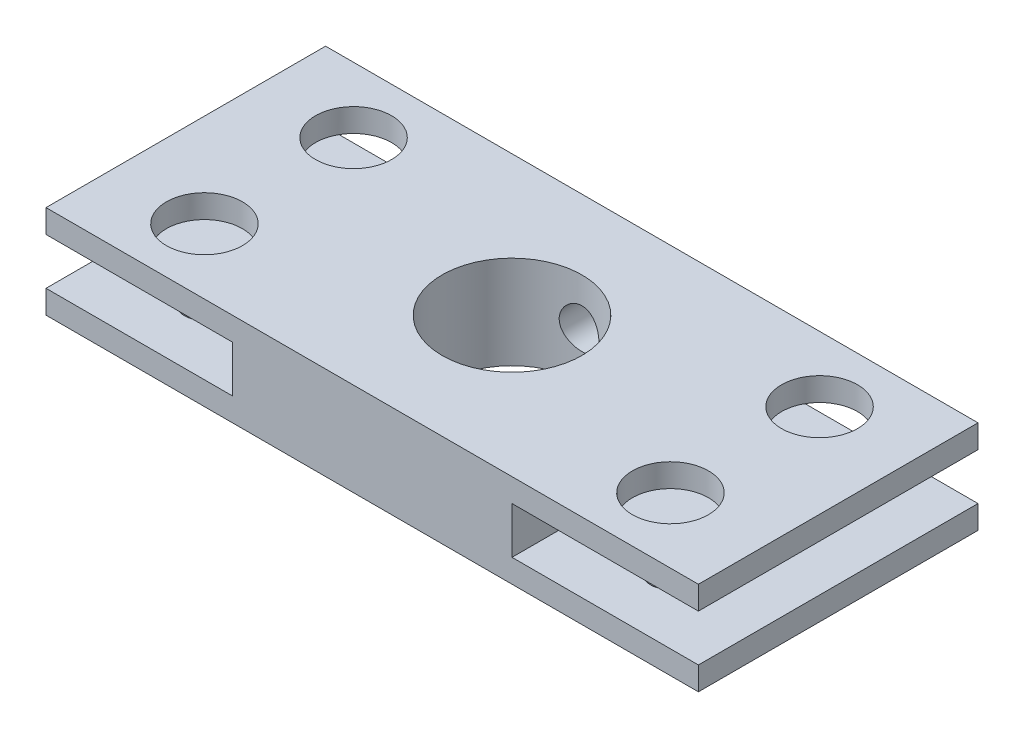
from build123d import *

# Parameters (mm, degrees)
SKETCH1_W                      = 44.45
SKETCH1_H                      = 19.05
SKETCH1_R                      = 4.7625
BOSS_EXTRUDE1_DEPTH            = 6.35
F_6_32_TAPPED_HOLE1_REACH      = 31.953
F_6_32_TAPPED_HOLE1_BORE_R     = 1.35255
SKETCH15_W                     = 12.7
SKETCH15_H                     = 3.175
CUT_EXTRUDE1_DEPTH             = 30.952890179
F_6_0_204_DIAMETER_HOLE1_D     = 5.1816
F_6_0_204_DIAMETER_HOLE1_DEPTH = 1.5875
F_6_32_TAPPED_HOLE4_D          = 2.7051


with BuildPart() as part:
    # Sketch1 → Boss-Extrude1 (new body)
    with BuildSketch(Plane(origin=(0, 0, 0), x_dir=(1, 0, 0), z_dir=(0, 1, 0))):
        Rectangle(SKETCH1_W, SKETCH1_H)
        with Locations(Location((0, 0, 0), (0, 0, 270))):
            Circle(SKETCH1_R, mode=Mode.SUBTRACT)
    extrude(amount=BOSS_EXTRUDE1_DEPTH)

    # #6-32 Tapped Hole1 bore → #6-32 Tapped Hole1 (cut, up to next)
    with BuildSketch(Plane(origin=(0, 0, -9.525), x_dir=(-1, 0, 0), z_dir=(0, 0, -1)), mode=Mode.PRIVATE) as f_6_32_tapped_hole1_sk1:
        with Locations((0, 3.175)):
            Circle(F_6_32_TAPPED_HOLE1_BORE_R)
    f_6_32_tapped_hole1_tool1 = extrude(f_6_32_tapped_hole1_sk1.sketch, amount=-F_6_32_TAPPED_HOLE1_REACH, mode=Mode.PRIVATE) & part.part
    add(f_6_32_tapped_hole1_tool1.solids().sort_by_distance((0, 3.175, -9.525))[0], mode=Mode.SUBTRACT)

    # Sketch15 → Cut-Extrude1 (cut, through all)
    with BuildSketch(Plane.XY.offset(9.525)):
        with Locations((15.875, 3.175)):
            Rectangle(SKETCH15_W, SKETCH15_H)
    cut_extrude1 = extrude(amount=-CUT_EXTRUDE1_DEPTH, mode=Mode.SUBTRACT)

    # #6 (0.204) Diameter Hole1
    with Locations(Plane(origin=(0, 6.35, 0), x_dir=(1, 0, 0), z_dir=(0, 1, 0))):
        with Locations((15.875, 5.08), (15.875, -5.08)):
            f_6_0_204_diameter_hole1 = Hole(F_6_0_204_DIAMETER_HOLE1_D / 2, depth=F_6_0_204_DIAMETER_HOLE1_DEPTH)

    # #6-32 Tapped Hole4 (through all)
    with Locations(Plane(origin=(0, 1.5875, 0), x_dir=(1, 0, 0), z_dir=(0, 1, 0))):
        with Locations((15.875, 5.08), (15.875, -5.08)):
            f_6_32_tapped_hole4 = Hole(F_6_32_TAPPED_HOLE4_D / 2)

    # Mirror3: Cut-Extrude1, #6 (0.204) Diameter Hole1, #6-32 Tapped Hole4 across plane
    add(cut_extrude1.mirror(Plane(origin=(0, 0, 0), x_dir=(0, 0, 1), z_dir=(1, 0, 0))), mode=Mode.SUBTRACT)
    add(f_6_0_204_diameter_hole1.mirror(Plane(origin=(0, 0, 0), x_dir=(0, 0, 1), z_dir=(1, 0, 0))), mode=Mode.SUBTRACT)
    add(f_6_32_tapped_hole4.mirror(Plane(origin=(0, 0, 0), x_dir=(0, 0, 1), z_dir=(1, 0, 0))), mode=Mode.SUBTRACT)


solid = part.part
